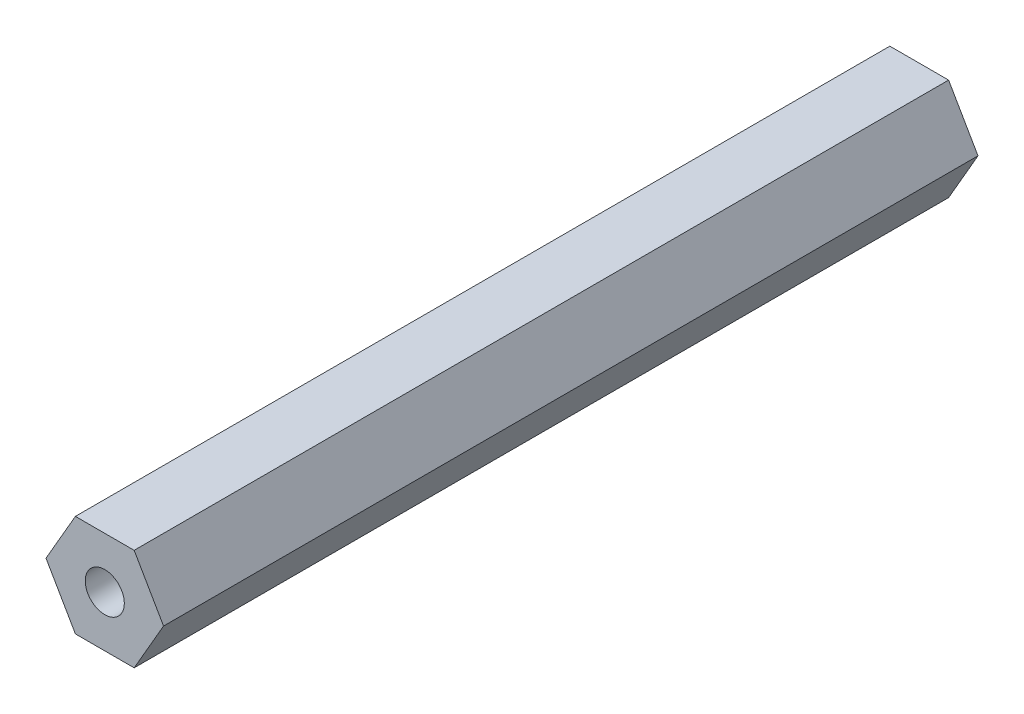
from build123d import *

# Parameters (mm, degrees)
BOSS_EXTRUDE1_DEPTH = 63.5
SKETCH2_R           = 1.524
CUT_EXTRUDE1_DEPTH  = 19.05
CUT_EXTRUDE2_START  = -19.05
SKETCH3_R           = 1.524
CUT_EXTRUDE2_DEPTH  = 19.05
SKETCH6_W           = 2.291358881
SKETCH6_H           = 1.5
CUT_EXTRUDE4_DEPTH  = 19.05


with BuildPart() as part:
    # Sketch1 → Boss-Extrude1 (new body)
    with BuildSketch(Plane.XY):
        Polygon((-117.870682238, 0), (-120.162041119, 3.96875), (-124.744758881, 3.96875), (-127.036117762, 0), (-124.744758881, -3.96875), (-120.162041119, -3.96875), align=None)
    extrude(amount=BOSS_EXTRUDE1_DEPTH)

    # Sketch2 → Cut-Extrude1 (cut)
    with BuildSketch(Plane.XY.offset(63.5)):
        with Locations((-122.4534, 0)):
            Circle(SKETCH2_R)
    extrude(amount=-CUT_EXTRUDE1_DEPTH, mode=Mode.SUBTRACT)

    # Sketch3 → Cut-Extrude2 (cut)
    with BuildSketch(Plane(origin=(0, 0, 0), x_dir=(-1, 0, 0), z_dir=(0, 0, -1)).offset(CUT_EXTRUDE2_START)):
        with Locations(Location((122.4534, 0, 0), (0, 0, 180))):
            Circle(SKETCH3_R)
    extrude(amount=CUT_EXTRUDE2_DEPTH, mode=Mode.SUBTRACT)

    # Sketch6 → Cut-Extrude4 (cut)
    with BuildSketch(Plane.XZ.offset(3.96875)):
        with Locations((-125.890438321, 5.08)):
            Rectangle(SKETCH6_W, SKETCH6_H)
        with Locations((-125.890438321, 10.16)):
            Rectangle(SKETCH6_W, SKETCH6_H)
        with Locations((-125.890438321, 15.24)):
            Rectangle(SKETCH6_W, SKETCH6_H)
        with Locations((-125.890438321, 20.32)):
            Rectangle(SKETCH6_W, SKETCH6_H)
        with Locations((-125.890438321, 25.4)):
            Rectangle(SKETCH6_W, SKETCH6_H)
        with Locations((-125.890438321, 30.48)):
            Rectangle(SKETCH6_W, SKETCH6_H)
        with Locations((-125.890438321, 35.56)):
            Rectangle(SKETCH6_W, SKETCH6_H)
        with Locations((-125.890438321, 40.64)):
            Rectangle(SKETCH6_W, SKETCH6_H)
        with Locations((-125.890438321, 45.72)):
            Rectangle(SKETCH6_W, SKETCH6_H)
        with Locations((-125.890438321, 50.8)):
            Rectangle(SKETCH6_W, SKETCH6_H)
        with Locations((-125.890438321, 55.88)):
            Rectangle(SKETCH6_W, SKETCH6_H)
        with Locations((-125.890438321, 60.96)):
            Rectangle(SKETCH6_W, SKETCH6_H)
        with Locations((-125.890438321, 66.04)):
            Rectangle(SKETCH6_W, SKETCH6_H)
        with Locations((-125.890438321, 71.12)):
            Rectangle(SKETCH6_W, SKETCH6_H)
    extrude(amount=-CUT_EXTRUDE4_DEPTH, mode=Mode.SUBTRACT)


solid = part.part
